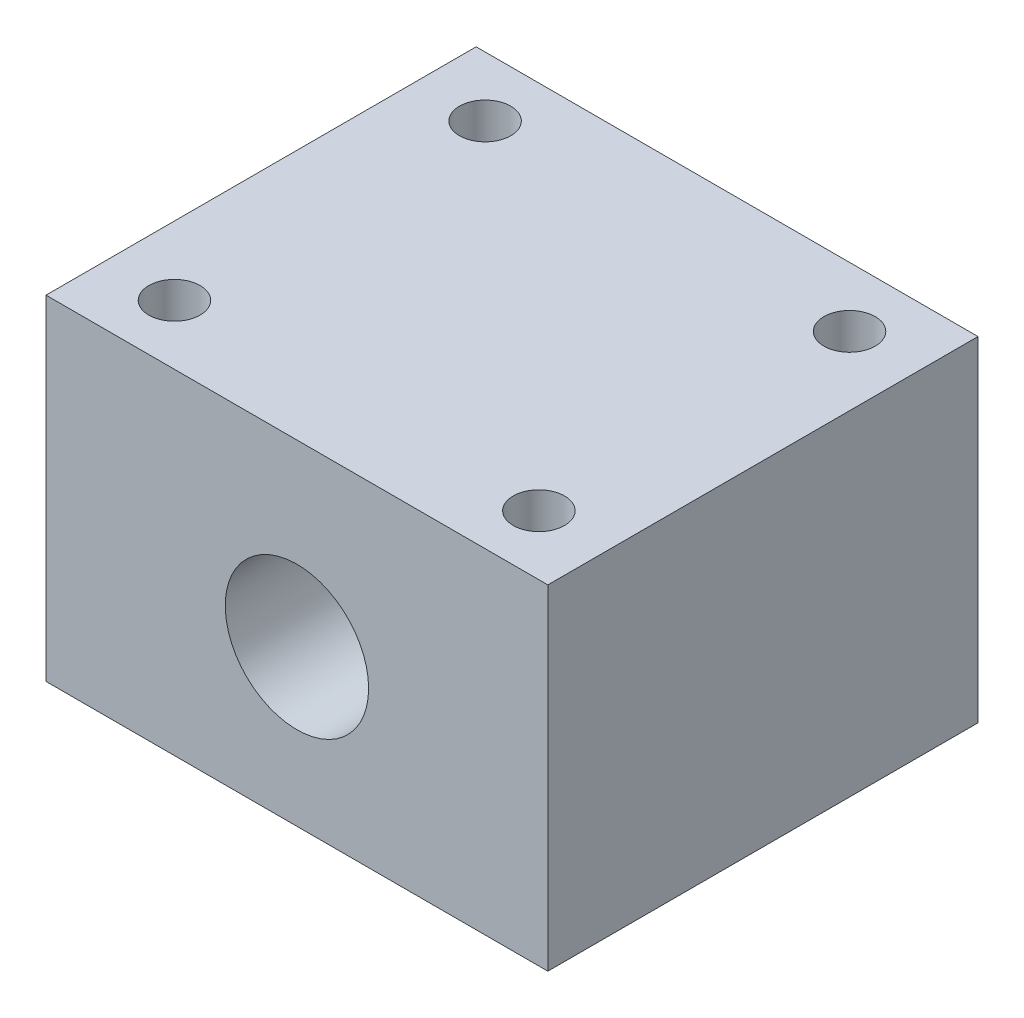
from build123d import *

# Parameters (mm, degrees)
SKETCH1_W           = 42
SKETCH1_H           = 28
SKETCH1_R           = 6
BOSS_EXTRUDE1_DEPTH = 36
SKETCH2_R           = 2.1463
CUT_EXTRUDE1_DEPTH  = 51.209560843


with BuildPart() as part:
    # Sketch1 → Boss-Extrude1 (new body)
    with BuildSketch(Plane.XY):
        with Locations((0, 1)):
            Rectangle(SKETCH1_W, SKETCH1_H)
        Circle(SKETCH1_R, mode=Mode.SUBTRACT)
    extrude(amount=BOSS_EXTRUDE1_DEPTH)

    # Sketch2 → Cut-Extrude1 (cut, through all)
    with BuildSketch(Plane(origin=(0, 15, 0), x_dir=(1, 0, 0), z_dir=(0, 1, 0))):
        with Locations(Location((-15.25, -5, 0), (0, 0, 270))):
            Circle(SKETCH2_R)
        with Locations(Location((15.25, -5, 0), (0, 0, 270))):
            Circle(SKETCH2_R)
        with Locations(Location((15.25, -31, 0), (0, 0, 270))):
            Circle(SKETCH2_R)
        with Locations(Location((-15.25, -31, 0), (0, 0, 270))):
            Circle(SKETCH2_R)
    extrude(amount=-CUT_EXTRUDE1_DEPTH, mode=Mode.SUBTRACT)


solid = part.part
